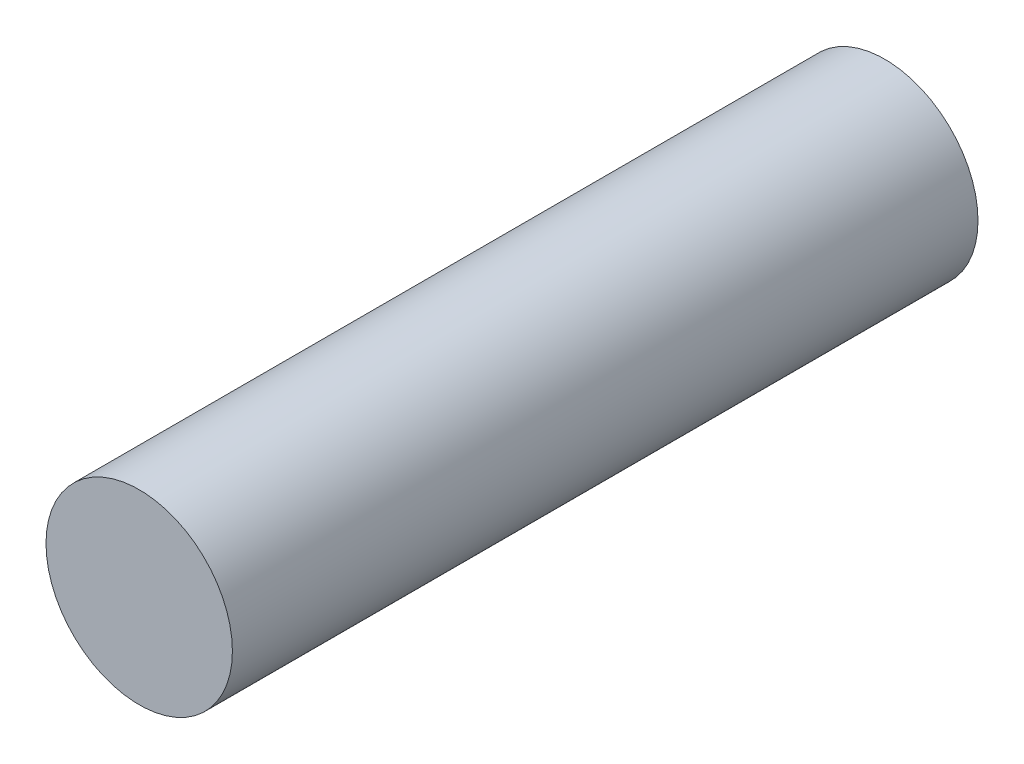
from build123d import *

# Parameters (mm, degrees)
SKETCH1_R           = 12.7
BOSS_EXTRUDE1_DEPTH = 101.6


with BuildPart() as part:
    # Sketch1 → Boss-Extrude1 (new body)
    with BuildSketch(Plane.XY):
        Circle(SKETCH1_R)
    extrude(amount=BOSS_EXTRUDE1_DEPTH)


solid = part.part
